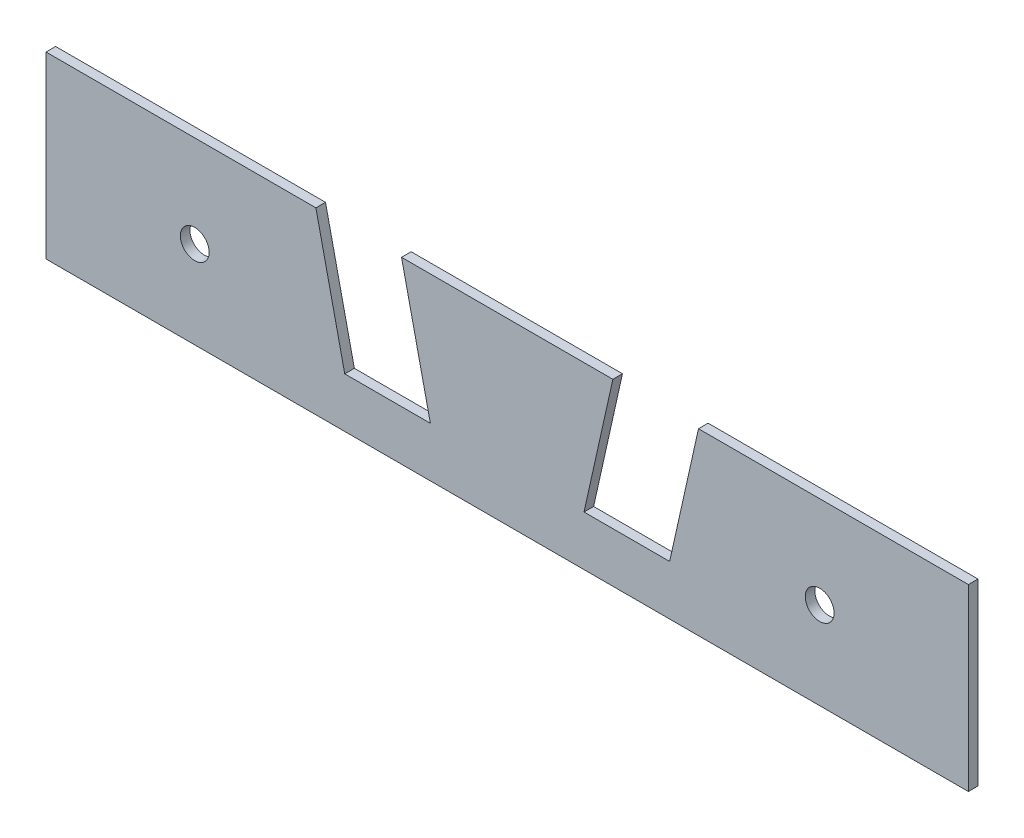
from build123d import *

# Parameters (mm, degrees)
SKETCH_1_R      = 1.5
EXTRUDE_1_DEPTH = 1


with BuildPart() as part:
    # Эскиз1 → Бобышка-Вытянуть1 (new body)
    with BuildSketch(Plane.XY):
        Polygon((19.909743959, -34.796210945), (48, -34.796210945), (48, -53.454190801), (-48, -53.454190801), (-48, -34.796210945), (-19.909743959, -34.796210945), (-16.907759352, -48.261049679), (-7.995261788, -48.261049679), (-10.997246395, -34.796210945), (10.997246395, -34.796210945), (7.995261788, -48.261049679), (16.907759352, -48.261049679), align=None)
        with Locations((-32.521447951, -44.364529328)):
            Circle(SKETCH_1_R, mode=Mode.SUBTRACT)
        with Locations((32.521447951, -44.364529328)):
            Circle(SKETCH_1_R, mode=Mode.SUBTRACT)
    extrude(amount=EXTRUDE_1_DEPTH)


solid = part.part
